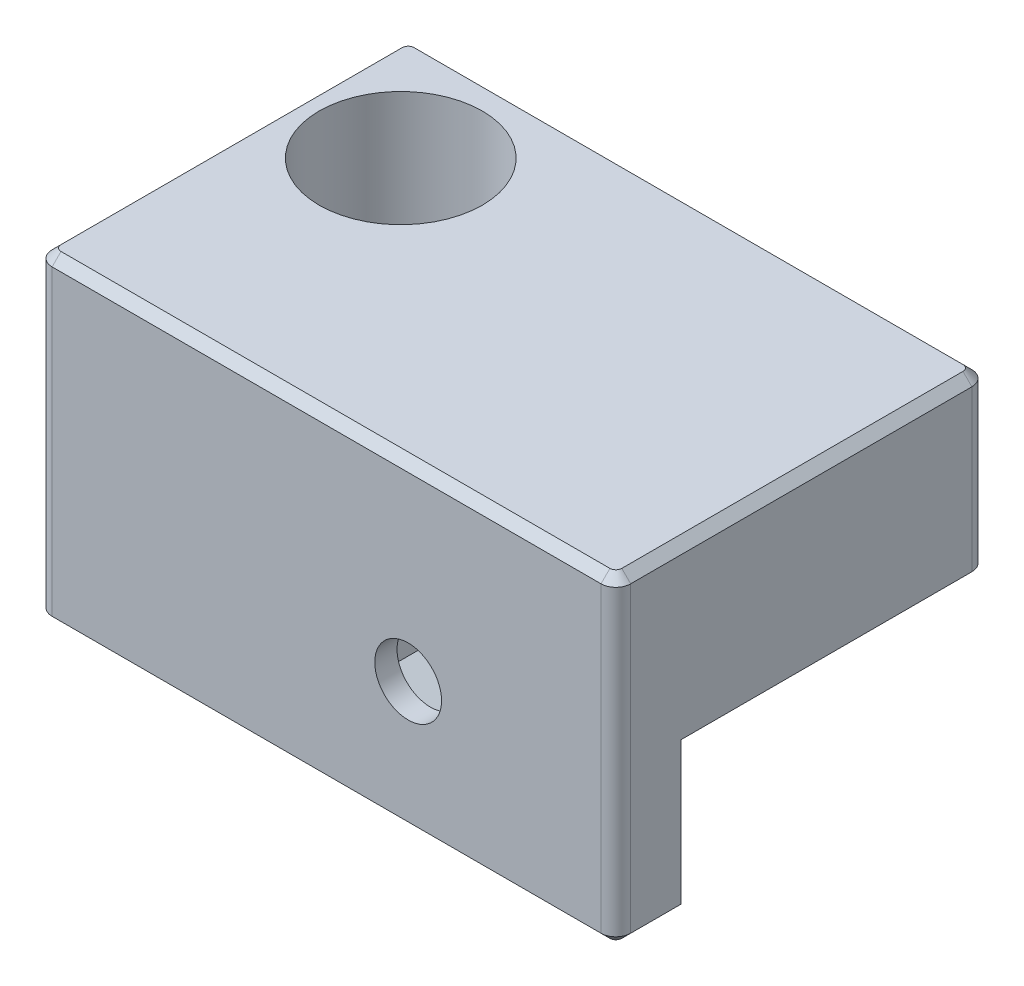
from build123d import *

# Parameters (mm, degrees)
BOSS_EXTRUDE1_DEPTH                                 = 7.5
CBORE_FOR_M6_HEX_SOCKET_HEAD_CAP_SCREW1_D           = 6.6
CBORE_FOR_M6_HEX_SOCKET_HEAD_CAP_SCREW1_CBORE_D     = 11
CBORE_FOR_M6_HEX_SOCKET_HEAD_CAP_SCREW1_CBORE_DEPTH = 9
BOSS_EXTRUDE2_DEPTH                                 = 5
SKETCH6_W                                           = 39
SKETCH6_H                                           = 21.6
BOSS_EXTRUDE3_DEPTH                                 = 5
CUT_EXTRUDE1_DEPTH                                  = 3.5
M4_CLEARANCE_HOLE1_D                                = 4.5
FILLET1_R                                           = 1
CHAMFER1_SIZE                                       = 0.6


with BuildPart() as part:
    # Sketch1 → Boss-Extrude1 (new, symmetric)
    with BuildSketch(Plane.XY):
        Polygon((0, 0), (0, 21.6), (39, 21.6), (39, 9.6), (35, 9.6), (35, 17.6), (15, 17.6), (15, 0), align=None)
    extrude(amount=BOSS_EXTRUDE1_DEPTH, both=True)

    # CBORE for M6 Hex Socket Head Cap Screw1 (through all)
    with Locations(Plane(origin=(0, 21.6, 0), x_dir=(1, 0, 0), z_dir=(0, 1, 0))):
        with Locations((7, 0)):
            CounterBoreHole(CBORE_FOR_M6_HEX_SOCKET_HEAD_CAP_SCREW1_D / 2, CBORE_FOR_M6_HEX_SOCKET_HEAD_CAP_SCREW1_CBORE_D / 2, CBORE_FOR_M6_HEX_SOCKET_HEAD_CAP_SCREW1_CBORE_DEPTH)

    # Sketch5 → Boss-Extrude2 (add)
    with BuildSketch(Plane.XY.offset(7.5)):
        Polygon((0, 0), (15, 0), (15, 17.6), (35, 17.6), (35, 9.6), (39, 9.6), (39, 21.6), (0, 21.6), align=None)
    extrude(amount=BOSS_EXTRUDE2_DEPTH)

    # Sketch6 → Boss-Extrude3 (add)
    with BuildSketch(Plane.XY.offset(12.5)):
        with Locations((19.5, 10.8)):
            Rectangle(SKETCH6_W, SKETCH6_H)
    extrude(amount=BOSS_EXTRUDE3_DEPTH)

    # Sketch7 → Cut-Extrude1 (cut)
    with BuildSketch(Plane(origin=(0, 0, 12.5), x_dir=(-1, 0, 0), z_dir=(0, 0, -1))):
        Polygon((-25, 4.758548116), (-21.5, 6.779274058), (-21.5, 10.820725942), (-25, 12.841451884), (-28.5, 10.820725942), (-28.5, 6.779274058), align=None)
    extrude(amount=-CUT_EXTRUDE1_DEPTH, mode=Mode.SUBTRACT)

    # M4 Clearance Hole1 (through all)
    with Locations(Plane(origin=(0, 0, 16), x_dir=(-1, 0, 0), z_dir=(0, 0, -1))):
        with Locations((-25, 8.8)):
            Hole(M4_CLEARANCE_HOLE1_D / 2)

    # Fillet1
    fillet1_edges = [part.edges().sort_by_distance(p)[0] for p in [
        (35, 9.6, 2.5),
        (0, 10.8, 17.5),
        (39, 10.8, 17.5),
        (0, 10.8, -7.5),
        (39, 15.6, -7.5),
    ]]
    fillet(fillet1_edges, radius=FILLET1_R)

    # Chamfer1
    chamfer1_edges = [part.edges().sort_by_distance(p)[0] for p in [
        (0.292893219, 21.6, -7.207106781),
        (38.707106781, 21.6, 17.207106781),
        (35, 14.1, -7.5),
        (38.707106781, 21.6, -7.207106781),
        (8, 0, -7.5),
        (37, 9.6, -7.5),
        (35.292893219, 9.892893219, -7.5),
        (25, 17.6, -7.5),
        (38.707106781, 9.6, -7.207106781),
        (19.5, 0, 17.5),
        (0, 0, 5),
        (15, 8.8, -7.5),
        (0.292893219, 0, 17.207106781),
        (0.292893219, 0, -7.207106781),
        (38.707106781, 0, 17.207106781),
        (39, 9.6, 3),
        (15, 0, 2.5),
        (10.3, 0, 0),
        (27, 0, 12.5),
        (39, 4.8, 12.5),
        (39, 21.6, 5),
        (39, 0, 14.5),
        (19.5, 21.6, -7.5),
        (0, 21.6, 5),
        (19.5, 21.6, 17.5),
        (0.292893219, 21.6, 17.207106781),
    ]]
    chamfer(chamfer1_edges, length=CHAMFER1_SIZE)


solid = part.part
